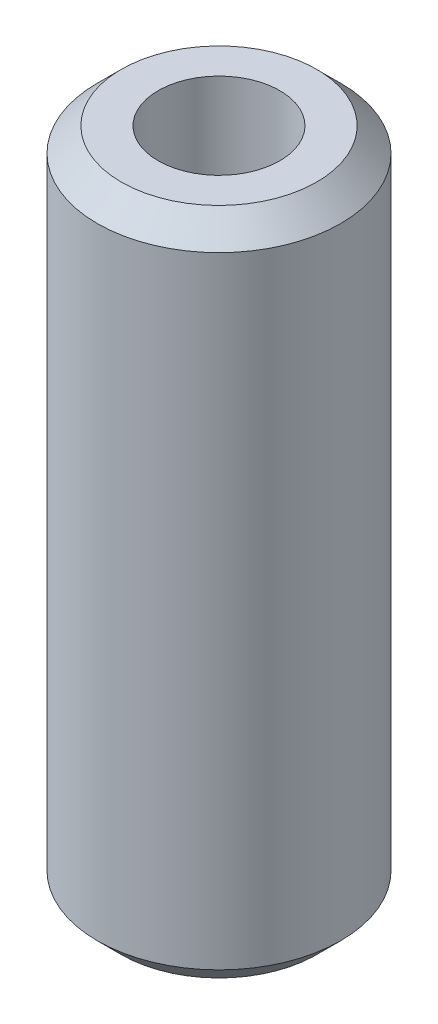
from build123d import *

# Parameters (mm, degrees)
ESQUISSE1_R        = 12.7
ESQUISSE1_R_2      = 6.35
BOSS_EXTRU_1_DEPTH = 34.925
CHANFREIN1_SIZE    = 2.5


with BuildPart() as part:
    # Esquisse1 → Boss.-Extru.1 (new, symmetric)
    with BuildSketch(Plane(origin=(0, 0, 0), x_dir=(1, 0, 0), z_dir=(0, 1, 0))):
        with Locations(Location((0, 0, 0), (0, 0, 270))):
            Circle(ESQUISSE1_R)
        with Locations(Location((0, 0, 0), (0, 0, 270))):
            Circle(ESQUISSE1_R_2, mode=Mode.SUBTRACT)
    extrude(amount=BOSS_EXTRU_1_DEPTH, both=True)

    # Chanfrein1
    chanfrein1_edges = [part.edges().sort_by_distance(p)[0] for p in [
        (0, -34.925, -12.7),
        (0, 34.925, -12.7),
    ]]
    chamfer(chanfrein1_edges, length=CHANFREIN1_SIZE)


solid = part.part
